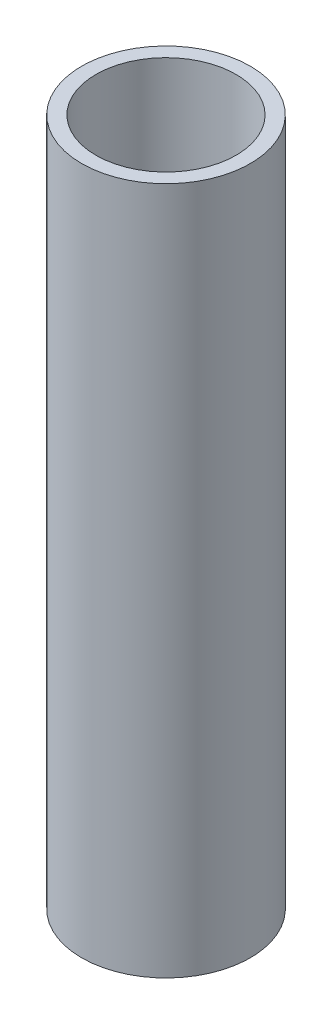
from build123d import *

# Parameters (mm, degrees)
SKETCH1_R           = 41.275
SKETCH1_R_2         = 37.465
BOSS_EXTRUDE1_DEPTH = 336.55
SKETCH2_R           = 39.661669625
SKETCH2_R_2         = 34.29
BOSS_EXTRUDE2_DEPTH = 93.472


with BuildPart() as part:
    # Sketch1 → Boss-Extrude1 (new body)
    with BuildSketch(Plane(origin=(0, 0, 0), x_dir=(1, 0, 0), z_dir=(0, 1, 0))):
        with Locations(Location((0, 0, 0), (0, 0, 270))):
            Circle(SKETCH1_R)
        with Locations(Location((0, 0, 0), (0, 0, 270))):
            Circle(SKETCH1_R_2, mode=Mode.SUBTRACT)
    extrude(amount=BOSS_EXTRUDE1_DEPTH)

    # Sketch2 → Boss-Extrude2 (add)
    with BuildSketch(Plane(origin=(0, 336.55, 0), x_dir=(1, 0, 0), z_dir=(0, 1, 0))):
        Circle(SKETCH2_R)
        with Locations(Location((0, 0, 0), (0, 0, 270))):
            Circle(SKETCH2_R_2, mode=Mode.SUBTRACT)
    extrude(amount=-BOSS_EXTRUDE2_DEPTH)


solid = part.part
